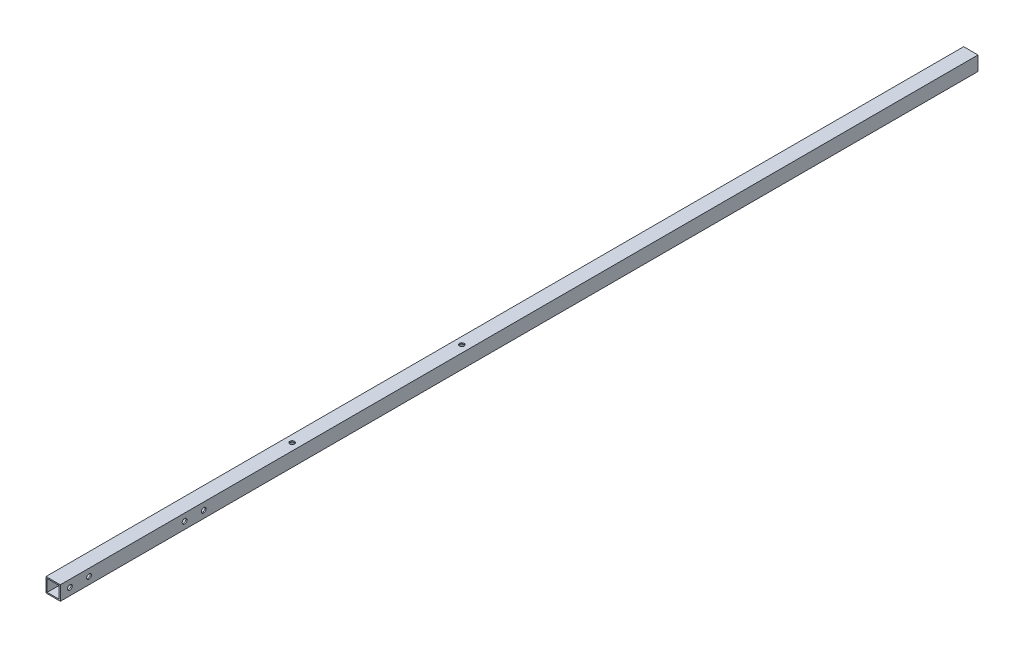
from build123d import *

# Parameters (mm, degrees)
SKETCH1_W               = 19.05
SKETCH1_H               = 19.05
SKETCH1_W_2             = 15.875
SKETCH1_H_2             = 15.875
BOSS_EXTRUDE1_DEPTH     = 609.6
SKETCH3_R               = 3.175
CUT_EXTRUDE1_DEPTH      = 610.971956835
SKETCH4_R               = 3.175
CUT_EXTRUDE2_DEPTH      = 610.971956835
CUT_EXTRUDE4_DEPTH      = 610.971956835
CUT_EXTRUDE4_DEPTH_BACK = 610.971956835
SKETCH7_R               = 3.175


with BuildPart() as part:
    # Sketch1 → Boss-Extrude1 (new, symmetric)
    with BuildSketch(Plane.XY):
        Rectangle(SKETCH1_W, SKETCH1_H)
        Rectangle(SKETCH1_W_2, SKETCH1_H_2, mode=Mode.SUBTRACT)
    extrude(amount=BOSS_EXTRUDE1_DEPTH, both=True)

    # Sketch3 → Cut-Extrude1 (cut, through all)
    with BuildSketch(Plane(origin=(9.525, 0, 0), x_dir=(0, 0, -1), z_dir=(1, 0, 0))):
        with Locations((-571.5, 0)):
            Circle(SKETCH3_R)
        with Locations((-596.9, 0)):
            Circle(SKETCH3_R)
    extrude(amount=-CUT_EXTRUDE1_DEPTH, mode=Mode.SUBTRACT)

    # Sketch4 → Cut-Extrude2 (cut, through all)
    with BuildSketch(Plane.ZY.offset(9.525)):
        with Locations((444.5, 0)):
            Circle(SKETCH4_R)
        with Locations((419.1, 0)):
            Circle(SKETCH4_R)
    extrude(amount=-CUT_EXTRUDE2_DEPTH, mode=Mode.SUBTRACT)

    # Sketch7 → Cut-Extrude4 (cut, two sides: drawn at the far end of the back side and taken through both)
    with BuildSketch(Plane.XZ.offset(9.525).offset(-CUT_EXTRUDE4_DEPTH_BACK)):
        with Locations(Location((0, 292.1, 0), (0, 0, 90))):
            Circle(SKETCH7_R)
        with Locations(Location((0, 66.675, 0), (0, 0, 90))):
            Circle(SKETCH7_R)
    extrude(amount=CUT_EXTRUDE4_DEPTH + CUT_EXTRUDE4_DEPTH_BACK, mode=Mode.SUBTRACT)


solid = part.part
